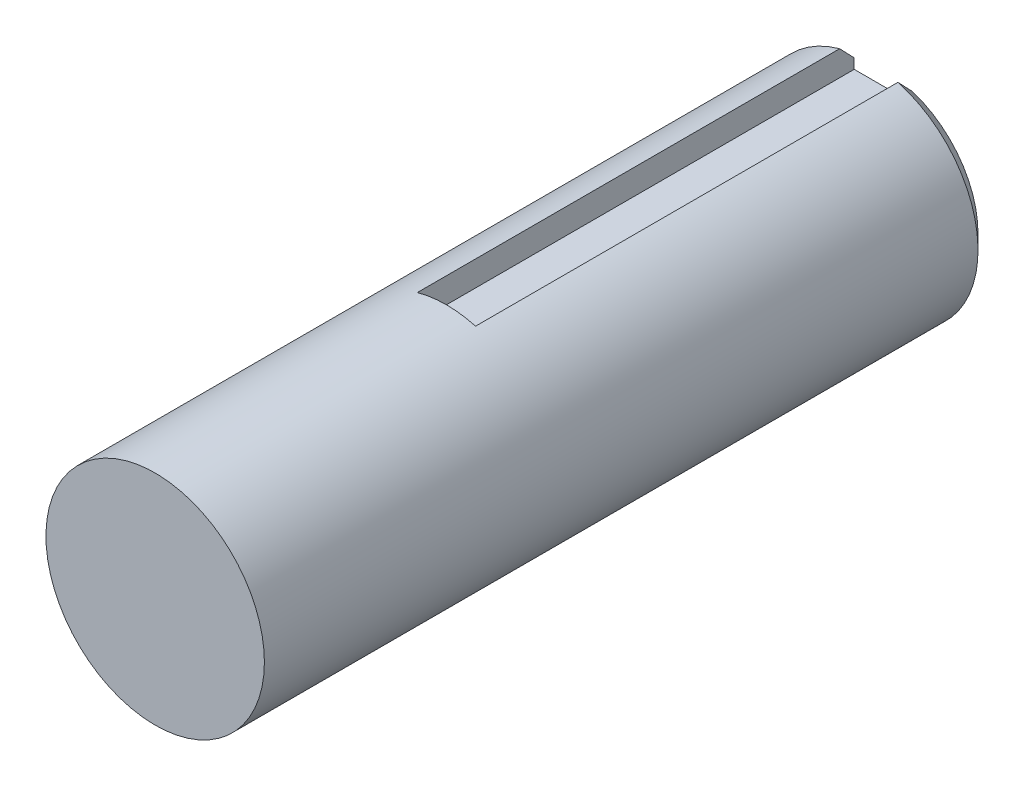
from build123d import *

# Parameters (mm, degrees)
SKETCH1_R           = 15
BOSS_EXTRUDE1_DEPTH = 100
CHAMFER1_SIZE       = 2
SKETCH3_W           = 8
SKETCH3_H           = 60
CUT_EXTRUDE1_DEPTH  = 4
FILLET1_R           = 3
ESCALA1_SCALE       = 0.5


with BuildPart() as part:
    # Sketch1 → Boss-Extrude1 (new body)
    with BuildSketch(Plane.XY):
        Circle(SKETCH1_R)
    extrude(amount=BOSS_EXTRUDE1_DEPTH)

    # Chamfer1
    chamfer1_edges = [part.edges().sort_by_distance(p)[0] for p in [
        (-15, 0, 0),
    ]]
    chamfer(chamfer1_edges, length=CHAMFER1_SIZE)

    # Sketch3 → Cut-Extrude1 (cut)
    with BuildSketch(Plane(origin=(0, 15, 100), x_dir=(1, 0, 0), z_dir=(0, 1, 0))):
        with Locations((0, 70)):
            Rectangle(SKETCH3_W, SKETCH3_H)
    extrude(amount=-CUT_EXTRUDE1_DEPTH, mode=Mode.SUBTRACT)

    # Fillet1
    fillet1_edges = [part.edges().sort_by_distance(p)[0] for p in [
        (0, 11, 60),
    ]]
    fillet(fillet1_edges, radius=FILLET1_R)


with BuildPart() as part_1:
    # Escala1: scaled about (0, -0.338706131, 50.653578584)
    add(part.part.scale(ESCALA1_SCALE).moved(Location((0, -0.169353066, 25.326789292))))


solid = part_1.part
